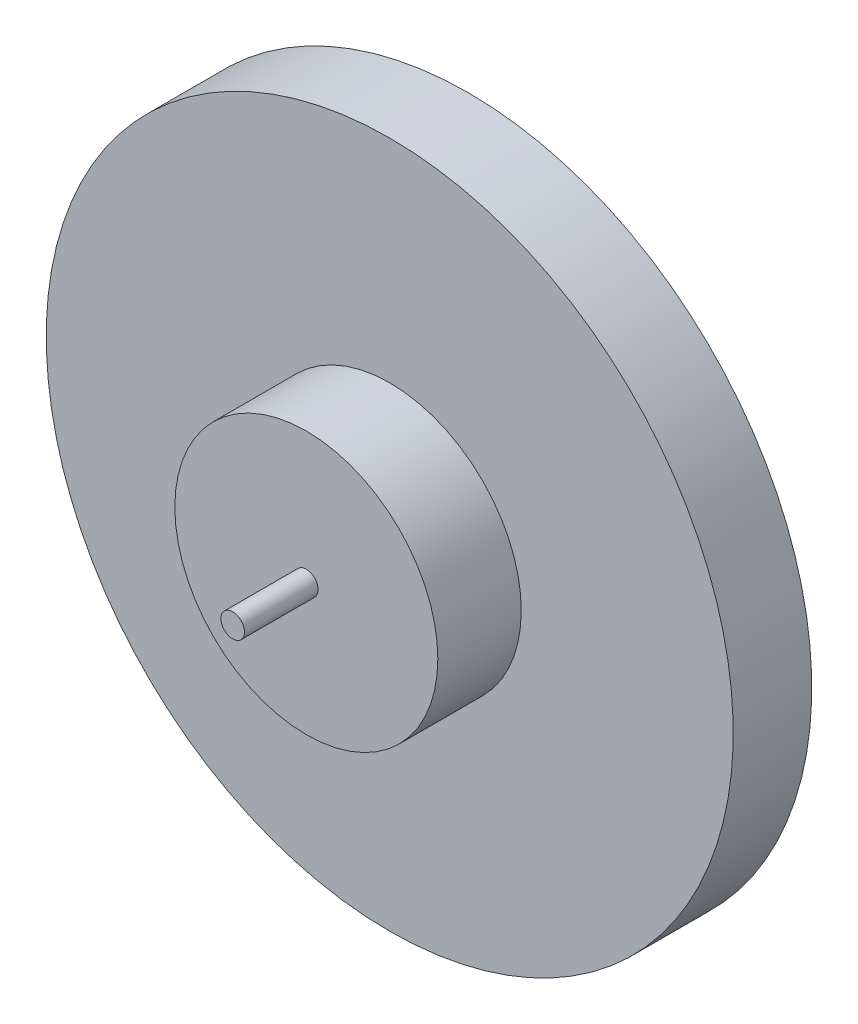
from build123d import *


with BuildPart() as part:
    # 草图3 → 旋转1 (revolve)
    with BuildSketch(Plane(origin=(0, 0, 0), x_dir=(0, 0, -1), z_dir=(1, 0, 0))):
        Polygon((0, 0), (0, 175), (20, 175), (20, 67), (62.5, 67), (62.5, 6), (100, 6), (100, 0), align=None)
    revolve_1 = revolve(axis=Axis((0, 0, -100), (0, 0, 1)))

    # 镜向1: 旋转1 across plane
    add(revolve_1.mirror(Plane.XY))


solid = part.part
